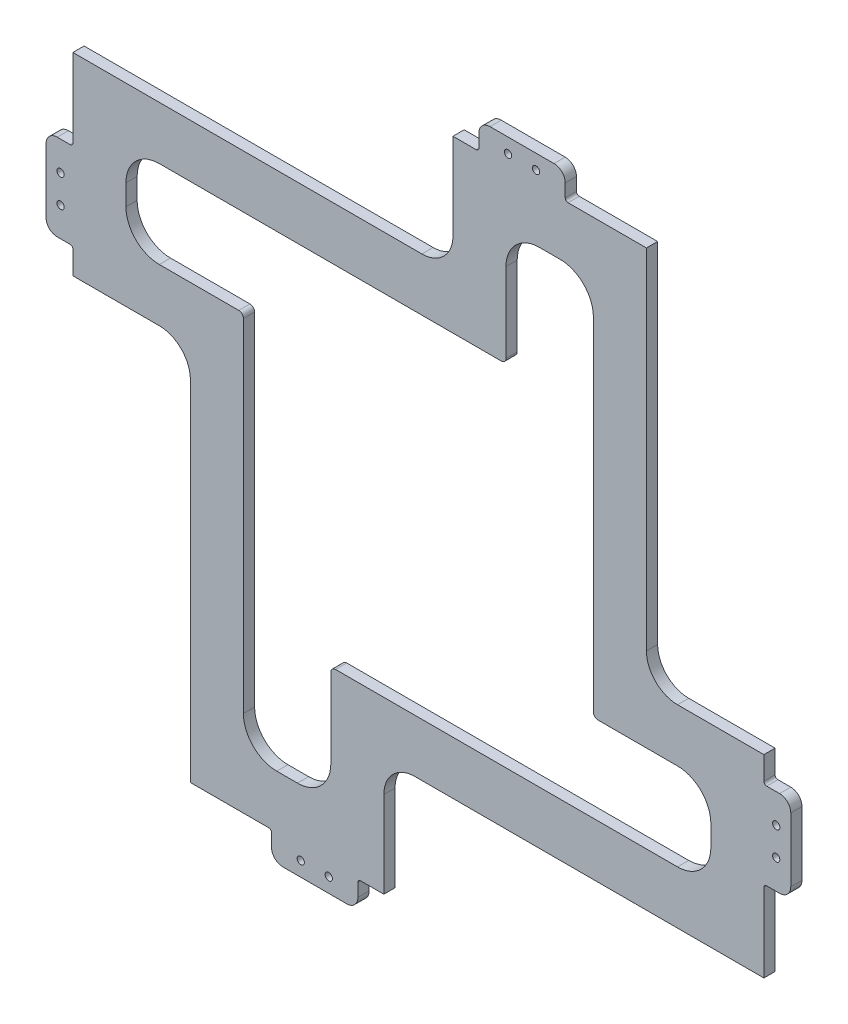
from build123d import *

# Parameters (mm, degrees)
SKETCH2_R          = 0.1651
EXTRUDE1_DEPTH     = 0.254
CIRPATTERN1_COUNT  = 4
CUT_EXTRUDE3_DEPTH = 0.635


with BuildPart() as part:
    # Sketch2 → Extrude1 (new, symmetric)
    with BuildSketch(Plane.XY):
        with BuildLine():
            Line((-6.26872, 7.8359), (3.761232, 7.8359))
            ThreePointArc((3.761232, 7.8359), (3.982864721, 7.927703279), (4.074668, 8.149336))
            Line((4.074668, 8.149336), (4.074668, 11.75385))
            ThreePointArc((4.074668, 11.75385), (4.487782755, 12.751197245), (5.48513, 13.164312))
            Line((5.48513, 13.164312), (6.425438, 13.164312))
            ThreePointArc((6.425438, 13.164312), (7.422785245, 12.751197245), (7.8359, 11.75385))
            Line((7.8359, 11.75385), (7.8359, 3.13436))
            Line((7.8359, 3.13436), (10.343388, 3.13436))
            Line((10.343388, 3.13436), (10.343388, 15.6718))
            Line((10.343388, 15.6718), (6.787515, 15.6718))
            ThreePointArc((6.787515, 15.6718), (6.697712439, 15.708997439), (6.660515, 15.7988))
            Line((6.660515, 15.7988), (6.660515, 16.383))
            ThreePointArc((6.660515, 16.383), (6.511725245, 16.742210245), (6.152515, 16.891))
            Line((6.152515, 16.891), (3.250565, 16.891))
            ThreePointArc((3.250565, 16.891), (2.891354755, 16.742210245), (2.742565, 16.383))
            Line((2.742565, 16.383), (2.742565, 15.7988))
            ThreePointArc((2.742565, 15.7988), (2.705367561, 15.708997439), (2.615565, 15.6718))
            Line((2.615565, 15.6718), (1.56718, 15.6718))
            Line((1.56718, 15.6718), (1.56718, 11.75385))
            ThreePointArc((1.56718, 11.75385), (1.154065245, 10.756502755), (0.156718, 10.343388))
            Line((0.156718, 10.343388), (-6.26872, 10.343388))
            Line((-6.26872, 10.343388), (-6.26872, 7.8359))
        make_face()
        with Locations((4.06654, 16.2306)):
            Circle(SKETCH2_R, mode=Mode.SUBTRACT)
        with Locations((5.33654, 16.2306)):
            Circle(SKETCH2_R, mode=Mode.SUBTRACT)
    extrude1 = extrude(amount=EXTRUDE1_DEPTH, both=True)

    # CirPattern1: Extrude1 ×4 about axis
    cirpattern1_axis = Axis((0, 0, -69.733664692), (0, 0, 1))
    for i in range(1, CIRPATTERN1_COUNT):
        add(extrude1.rotate(cirpattern1_axis, i * 360 / CIRPATTERN1_COUNT))

    # Sketch7 → Cut-Extrude3 (cut)
    with BuildSketch(Plane.XY.offset(0.254)):
        with BuildLine():
            Line((-11.75385, 3.973068), (-8.149336, 3.973068))
            ThreePointArc((-8.149336, 3.973068), (-7.999545328, 3.911022672), (-7.9375, 3.761232))
            Line((-7.9375, 3.761232), (-7.9375, -11.75385))
            ThreePointArc((-7.9375, -11.75385), (-7.494627294, -12.823039294), (-6.425438, -13.265912))
            Line((-6.425438, -13.265912), (-5.48513, -13.265912))
            ThreePointArc((-5.48513, -13.265912), (-4.415940706, -12.823039294), (-3.973068, -11.75385))
            Line((-3.973068, -11.75385), (-3.973068, -8.149336))
            ThreePointArc((-3.973068, -8.149336), (-3.911022672, -7.999545328), (-3.761232, -7.9375))
            Line((-3.761232, -7.9375), (11.75385, -7.9375))
            ThreePointArc((11.75385, -7.9375), (12.823039294, -7.494627294), (13.265912, -6.425438))
            Line((13.265912, -6.425438), (13.265912, -5.48513))
            ThreePointArc((13.265912, -5.48513), (12.823039294, -4.415940706), (11.75385, -3.973068))
            Line((11.75385, -3.973068), (8.149336, -3.973068))
            ThreePointArc((8.149336, -3.973068), (7.999545328, -3.911022672), (7.9375, -3.761232))
            Line((7.9375, -3.761232), (7.9375, 11.75385))
            ThreePointArc((7.9375, 11.75385), (7.494627294, 12.823039294), (6.425438, 13.265912))
            Line((6.425438, 13.265912), (5.48513, 13.265912))
            ThreePointArc((5.48513, 13.265912), (4.415940706, 12.823039294), (3.973068, 11.75385))
            Line((3.973068, 11.75385), (3.973068, 8.149336))
            ThreePointArc((3.973068, 8.149336), (3.911022672, 7.999545328), (3.761232, 7.9375))
            Line((3.761232, 7.9375), (-11.75385, 7.9375))
            ThreePointArc((-11.75385, 7.9375), (-12.823039294, 7.494627294), (-13.265912, 6.425438))
            Line((-13.265912, 6.425438), (-13.265912, 5.48513))
            ThreePointArc((-13.265912, 5.48513), (-12.823039294, 4.415940706), (-11.75385, 3.973068))
        make_face()
    extrude(amount=-CUT_EXTRUDE3_DEPTH, mode=Mode.SUBTRACT)


solid = part.part
